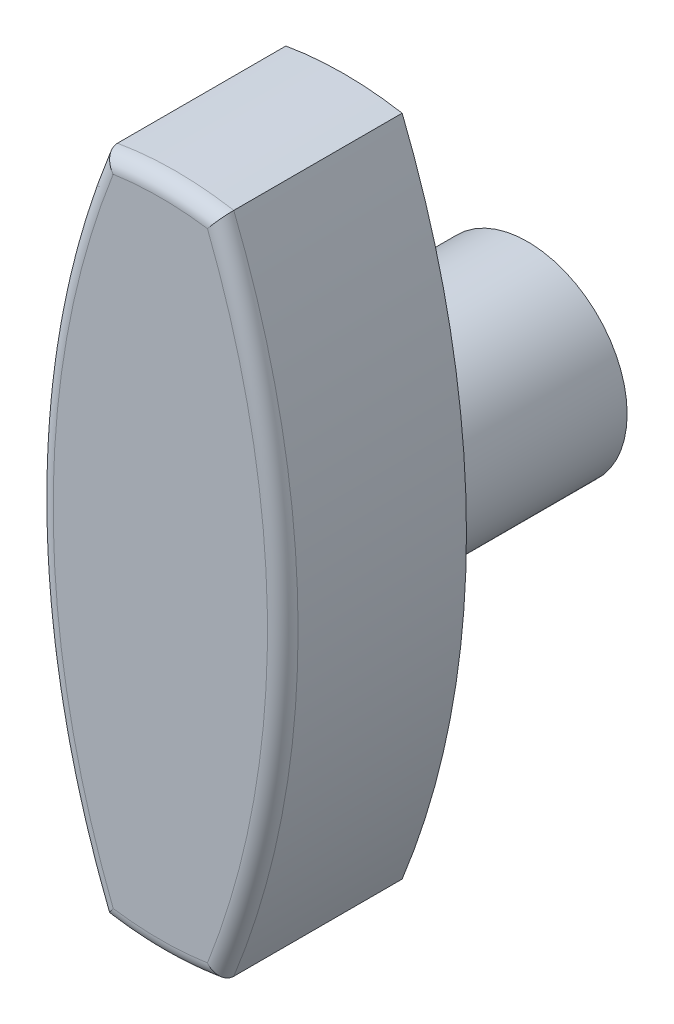
from build123d import *

# Parameters (mm, degrees)
SKETCH1_R           = 6.5
BOSS_EXTRUDE1_DEPTH = 12
BOSS_EXTRUDE2_DEPTH = 12
FILLET1_R           = 1


with BuildPart() as part:
    # Sketch1 → Boss-Extrude1 (new body)
    with BuildSketch(Plane.XY):
        Circle(SKETCH1_R)
        with BuildLine():
            Line((-2.645751311, -3), (2.645751311, -3))
            ThreePointArc((2.645751311, -3), (0, 4), (-2.645751311, -3))
        make_face(mode=Mode.SUBTRACT)
    extrude(amount=BOSS_EXTRUDE1_DEPTH)

    # Sketch2 → Boss-Extrude2 (add)
    with BuildSketch(Plane.XY.offset(12)):
        with BuildLine():
            ThreePointArc((3.8, 21.669333169), (8, 0), (3.8, -21.669333169))
            ThreePointArc((3.8, -21.669333169), (0, -22), (-3.8, -21.669333169))
            ThreePointArc((-3.8, -21.669333169), (-8, 0), (-3.8, 21.669333169))
            ThreePointArc((-3.8, 21.669333169), (0, 22), (3.8, 21.669333169))
        make_face()
    extrude(amount=BOSS_EXTRUDE2_DEPTH)

    # Fillet1
    fillet1_edges = [part.edges().sort_by_distance(p)[0] for p in [
        (0, 22, 24),
        (-8, 0, 24),
        (0, -22, 24),
        (8, 0, 24),
    ]]
    fillet(fillet1_edges, radius=FILLET1_R)


solid = part.part
